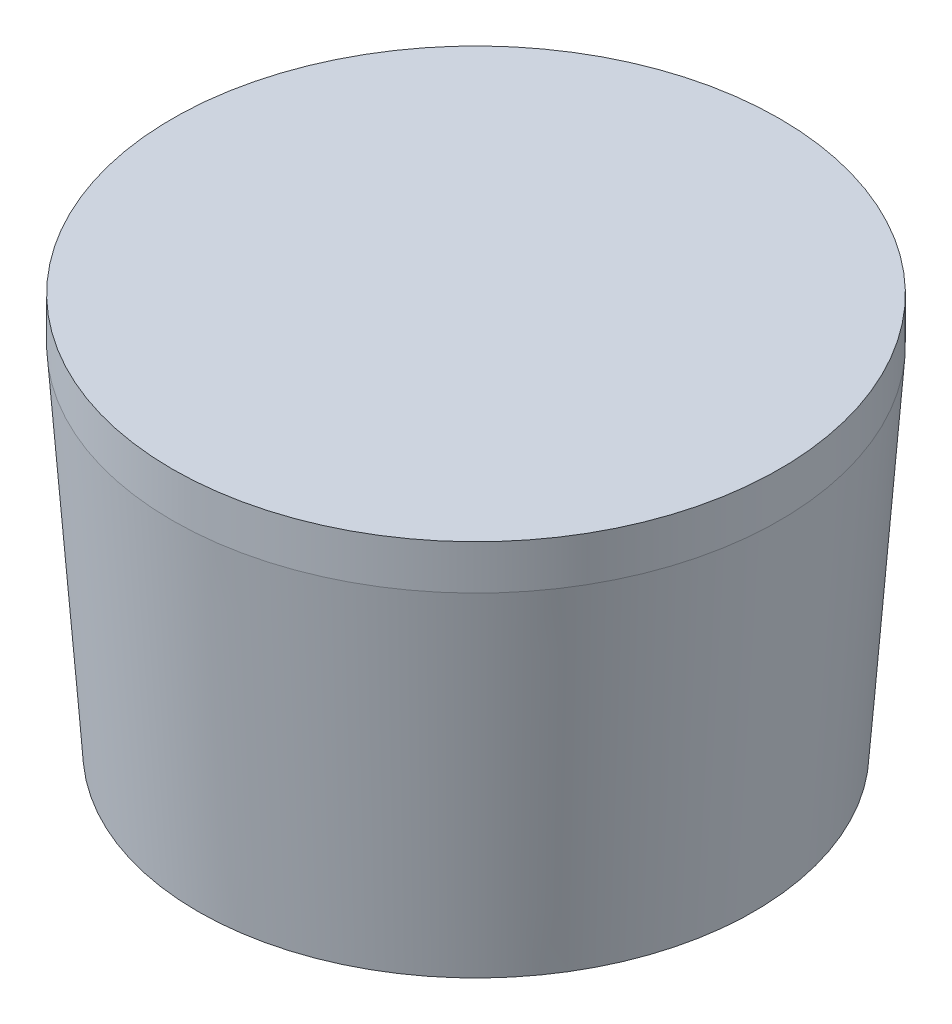
from build123d import *

# Parameters (mm, degrees)
IZIM10_R                    = 136.5
IZIM9_R                     = 125
IZIM11_R                    = 136.5
Y_KSEKLIK_EKSTR_ZYON2_DEPTH = 20
IZIM12_R                    = 79
KES_EKSTR_ZYON3_DEPTH       = 12.5
KUBBE3_FACE_RADIUS          = 79
KUBBE3_HEIGHT               = 5


with BuildPart() as part:
    # Çizim10 → Loft2 section 0
    with BuildSketch(Plane(origin=(0, 158, 0), x_dir=(1, 0, 0), z_dir=(0, 1, 0))):
        Circle(IZIM10_R)
    # Çizim9 → Loft2 section 1
    with BuildSketch(Plane(origin=(0, 0, 0), x_dir=(1, 0, 0), z_dir=(0, 1, 0))):
        Circle(IZIM9_R)
    loft()

    # Çizim11 → Yükseklik-Ekstrüzyon2 (add)
    with BuildSketch(Plane(origin=(0, 158, 0), x_dir=(1, 0, 0), z_dir=(0, 1, 0))):
        with Locations(Location((0, 0, 0), (0, 0, 270))):
            Circle(IZIM11_R)
    extrude(amount=Y_KSEKLIK_EKSTR_ZYON2_DEPTH)

    # Çizim12 → Kes-Ekstrüzyon3 (cut)
    with BuildSketch(Plane.XZ):
        with Locations(Location((0, 0, 0), (0, 0, 270))):
            Circle(IZIM12_R)
    extrude(amount=-KES_EKSTR_ZYON3_DEPTH, mode=Mode.SUBTRACT)

    # Kubbe3: a dome of height H over a round flat face of radius A is a cap of a sphere of radius (A * A + H * H) / (2 * H)
    kubbe3_r = (KUBBE3_FACE_RADIUS * KUBBE3_FACE_RADIUS + KUBBE3_HEIGHT * KUBBE3_HEIGHT) / (2 * KUBBE3_HEIGHT)
    kubbe3_base = Plane((0, 12.5, 0), z_dir=(0, 1, 0))
    with Locations(kubbe3_base.offset(KUBBE3_HEIGHT - kubbe3_r)):
        kubbe3_ball = Sphere(kubbe3_r, mode=Mode.PRIVATE)
    add(split(kubbe3_ball, bisect_by=kubbe3_base, keep=Keep.TOP, mode=Mode.PRIVATE), mode=Mode.SUBTRACT)


solid = part.part
